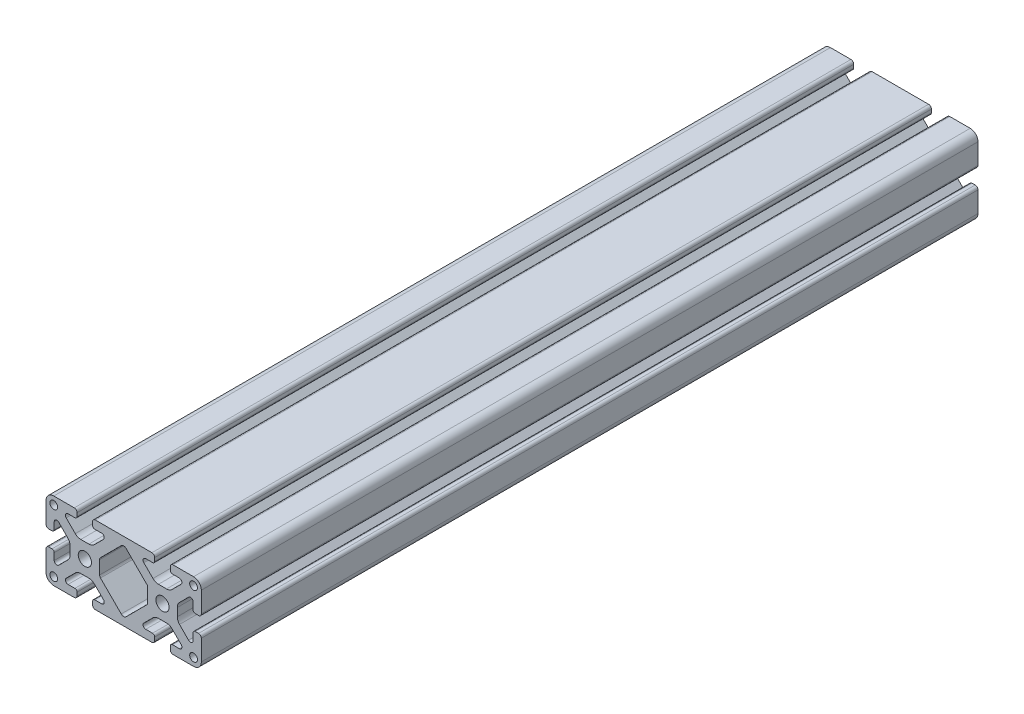
from build123d import *

# Parameters (mm, degrees)
SKETCH4_W              = 100
SKETCH4_H              = 50
BODY_DEPTH             = 500
CUT_PROFILE_DEPTH      = 257.173769149
CUT_PROFILE_DEPTH_BACK = 257.173769149
SKETCH6_OUTSIDE_W      = 204.47
SKETCH6_OUTSIDE_H      = 154.47
SKETCH6_OUTSIDE_R      = 4.25
SKETCH6_OUTSIDE_R_2    = 2.5


with BuildPart() as part:
    # Sketch4 → Body (new body)
    with BuildSketch(Plane.XY.offset(250)):
        Rectangle(SKETCH4_W, SKETCH4_H)
    extrude(amount=-BODY_DEPTH)

    # Sketch6 outside → Cut-Profile (cut, two sides: drawn at the far end of the back side and taken through both)
    # profile 1 of 8: a face of its own
    with BuildSketch(Plane.XY.offset(-CUT_PROFILE_DEPTH_BACK)):
        Rectangle(SKETCH6_OUTSIDE_W, SKETCH6_OUTSIDE_H)
        with BuildLine():
            Line((-31.4, -19.7), (-35.8, -19.7))
            ThreePointArc((-35.8, -19.7), (-37.371513222, -18.648341109), (-36.998678382, -16.794524933))
            Line((-36.998678382, -16.794524933), (-31.125524653, -10.954485098))
            ThreePointArc((-31.125524653, -10.954485098), (-29.506885614, -9.877902288), (-27.6, -9.5))
            Line((-27.6, -9.5), (-22.4, -9.5))
            ThreePointArc((-22.4, -9.5), (-20.493114386, -9.877902288), (-18.874475347, -10.954485098))
            Line((-18.874475347, -10.954485098), (-13.001321618, -16.794524933))
            ThreePointArc((-13.001321618, -16.794524933), (-12.628486778, -18.648341109), (-14.2, -19.7))
            Line((-14.2, -19.7), (-18.6, -19.7))
            ThreePointArc((-18.6, -19.7), (-19.589949494, -20.110050506), (-20, -21.1))
            Line((-20, -21.1), (-20, -23.2))
            ThreePointArc((-20, -23.2), (-19.472792206, -24.472792206), (-18.2, -25))
            Line((-18.2, -25), (18.2, -25))
            ThreePointArc((18.2, -25), (19.472792206, -24.472792206), (20, -23.2))
            Line((20, -23.2), (20, -21.1))
            ThreePointArc((20, -21.1), (19.589949494, -20.110050506), (18.6, -19.7))
            Line((18.6, -19.7), (14.2, -19.7))
            ThreePointArc((14.2, -19.7), (12.628486778, -18.648341109), (13.001321618, -16.794524933))
            Line((13.001321618, -16.794524933), (18.874475347, -10.954485098))
            ThreePointArc((18.874475347, -10.954485098), (20.493114386, -9.877902288), (22.4, -9.5))
            Line((22.4, -9.5), (27.6, -9.5))
            ThreePointArc((27.6, -9.5), (29.506885614, -9.877902288), (31.125524653, -10.954485098))
            Line((31.125524653, -10.954485098), (36.998678382, -16.794524933))
            ThreePointArc((36.998678382, -16.794524933), (37.371513222, -18.648341109), (35.8, -19.7))
            Line((35.8, -19.7), (31.4, -19.7))
            ThreePointArc((31.4, -19.7), (30.410050506, -20.110050506), (30, -21.1))
            Line((30, -21.1), (30, -23.2))
            ThreePointArc((30, -23.2), (30.527207794, -24.472792206), (31.8, -25))
            Line((31.8, -25), (45, -25))
            ThreePointArc((45, -25), (48.535533906, -23.535533906), (50, -20))
            Line((50, -20), (50, -6.8))
            ThreePointArc((50, -6.8), (49.472792206, -5.527207794), (48.2, -5))
            Line((48.2, -5), (46.1, -5))
            ThreePointArc((46.1, -5), (45.110050506, -5.410050506), (44.7, -6.4))
            Line((44.7, -6.4), (44.7, -10.8))
            ThreePointArc((44.7, -10.8), (43.648341109, -12.371513222), (41.794524933, -11.998678382))
            Line((41.794524933, -11.998678382), (35.954485098, -6.125524653))
            ThreePointArc((35.954485098, -6.125524653), (34.877902288, -4.506885614), (34.5, -2.6))
            Line((34.5, -2.6), (34.5, 2.6))
            ThreePointArc((34.5, 2.6), (34.877902288, 4.506885614), (35.954485098, 6.125524653))
            Line((35.954485098, 6.125524653), (41.794524933, 11.998678382))
            ThreePointArc((41.794524933, 11.998678382), (43.648341109, 12.371513222), (44.7, 10.8))
            Line((44.7, 10.8), (44.7, 6.4))
            ThreePointArc((44.7, 6.4), (45.110050506, 5.410050506), (46.1, 5))
            Line((46.1, 5), (48.2, 5))
            ThreePointArc((48.2, 5), (49.472792206, 5.527207794), (50, 6.8))
            Line((50, 6.8), (50, 20))
            ThreePointArc((50, 20), (48.535533906, 23.535533906), (45, 25))
            Line((45, 25), (31.8, 25))
            ThreePointArc((31.8, 25), (30.527207794, 24.472792206), (30, 23.2))
            Line((30, 23.2), (30, 21.1))
            ThreePointArc((30, 21.1), (30.410050506, 20.110050506), (31.4, 19.7))
            Line((31.4, 19.7), (35.8, 19.7))
            ThreePointArc((35.8, 19.7), (37.371513222, 18.648341109), (36.998678382, 16.794524933))
            Line((36.998678382, 16.794524933), (31.125524653, 10.954485098))
            ThreePointArc((31.125524653, 10.954485098), (29.506885614, 9.877902288), (27.6, 9.5))
            Line((27.6, 9.5), (22.4, 9.5))
            ThreePointArc((22.4, 9.5), (20.493114386, 9.877902288), (18.874475347, 10.954485098))
            Line((18.874475347, 10.954485098), (13.001321618, 16.794524933))
            ThreePointArc((13.001321618, 16.794524933), (12.628486778, 18.648341109), (14.2, 19.7))
            Line((14.2, 19.7), (18.6, 19.7))
            ThreePointArc((18.6, 19.7), (19.589949494, 20.110050506), (20, 21.1))
            Line((20, 21.1), (20, 23.2))
            ThreePointArc((20, 23.2), (19.472792206, 24.472792206), (18.2, 25))
            Line((18.2, 25), (-18.2, 25))
            ThreePointArc((-18.2, 25), (-19.472792206, 24.472792206), (-20, 23.2))
            Line((-20, 23.2), (-20, 21.1))
            ThreePointArc((-20, 21.1), (-19.589949494, 20.110050506), (-18.6, 19.7))
            Line((-18.6, 19.7), (-14.2, 19.7))
            ThreePointArc((-14.2, 19.7), (-12.628486778, 18.648341109), (-13.001321618, 16.794524933))
            Line((-13.001321618, 16.794524933), (-18.874475347, 10.954485098))
            ThreePointArc((-18.874475347, 10.954485098), (-20.493114386, 9.877902288), (-22.4, 9.5))
            Line((-22.4, 9.5), (-27.6, 9.5))
            ThreePointArc((-27.6, 9.5), (-29.506885614, 9.877902288), (-31.125524653, 10.954485098))
            Line((-31.125524653, 10.954485098), (-36.998678382, 16.794524933))
            ThreePointArc((-36.998678382, 16.794524933), (-37.371513222, 18.648341109), (-35.8, 19.7))
            Line((-35.8, 19.7), (-31.4, 19.7))
            ThreePointArc((-31.4, 19.7), (-30.410050506, 20.110050506), (-30, 21.1))
            Line((-30, 21.1), (-30, 23.2))
            ThreePointArc((-30, 23.2), (-30.527207794, 24.472792206), (-31.8, 25))
            Line((-31.8, 25), (-45, 25))
            ThreePointArc((-45, 25), (-48.535533906, 23.535533906), (-50, 20))
            Line((-50, 20), (-50, 6.8))
            ThreePointArc((-50, 6.8), (-49.472792206, 5.527207794), (-48.2, 5))
            Line((-48.2, 5), (-46.1, 5))
            ThreePointArc((-46.1, 5), (-45.110050506, 5.410050506), (-44.7, 6.4))
            Line((-44.7, 6.4), (-44.7, 10.8))
            ThreePointArc((-44.7, 10.8), (-43.648341109, 12.371513222), (-41.794524933, 11.998678382))
            Line((-41.794524933, 11.998678382), (-35.954485098, 6.125524653))
            ThreePointArc((-35.954485098, 6.125524653), (-34.877902288, 4.506885614), (-34.5, 2.6))
            Line((-34.5, 2.6), (-34.5, -2.6))
            ThreePointArc((-34.5, -2.6), (-34.877902288, -4.506885614), (-35.954485098, -6.125524653))
            Line((-35.954485098, -6.125524653), (-41.794524933, -11.998678382))
            ThreePointArc((-41.794524933, -11.998678382), (-43.648341109, -12.371513222), (-44.7, -10.8))
            Line((-44.7, -10.8), (-44.7, -6.4))
            ThreePointArc((-44.7, -6.4), (-45.110050506, -5.410050506), (-46.1, -5))
            Line((-46.1, -5), (-48.2, -5))
            ThreePointArc((-48.2, -5), (-49.472792206, -5.527207794), (-50, -6.8))
            Line((-50, -6.8), (-50, -20))
            ThreePointArc((-50, -20), (-48.535533906, -23.535533906), (-45, -25))
            Line((-45, -25), (-31.8, -25))
            ThreePointArc((-31.8, -25), (-30.527207794, -24.472792206), (-30, -23.2))
            Line((-30, -23.2), (-30, -21.1))
            ThreePointArc((-30, -21.1), (-30.410050506, -20.110050506), (-31.4, -19.7))
        make_face(mode=Mode.SUBTRACT)
    # profile 2 of 8: a face of its own
    with BuildSketch(Plane.XY.offset(-CUT_PROFILE_DEPTH_BACK)):
        with Locations((25, 0)):
            Circle(SKETCH6_OUTSIDE_R)
    # profile 3 of 8: a face of its own
    with BuildSketch(Plane.XY.offset(-CUT_PROFILE_DEPTH_BACK)):
        with Locations((45, -20)):
            Circle(SKETCH6_OUTSIDE_R_2)
    # profile 4 of 8: a face of its own
    with BuildSketch(Plane.XY.offset(-CUT_PROFILE_DEPTH_BACK)):
        with Locations((45, 20)):
            Circle(SKETCH6_OUTSIDE_R_2)
    # profile 5 of 8: a face of its own
    with BuildSketch(Plane.XY.offset(-CUT_PROFILE_DEPTH_BACK)):
        with Locations((-45, -20)):
            Circle(SKETCH6_OUTSIDE_R_2)
    # profile 6 of 8: a face of its own
    with BuildSketch(Plane.XY.offset(-CUT_PROFILE_DEPTH_BACK)):
        with Locations((-45, 20)):
            Circle(SKETCH6_OUTSIDE_R_2)
    # profile 7 of 8: a face of its own
    with BuildSketch(Plane.XY.offset(-CUT_PROFILE_DEPTH_BACK)):
        with Locations((-25, 0)):
            Circle(SKETCH6_OUTSIDE_R)
    # profile 8 of 8: a face of its own
    with BuildSketch(Plane.XY.offset(-CUT_PROFILE_DEPTH_BACK)):
        with BuildLine():
            Line((14.914213562, 5.685786438), (1.555634919, 19.044365081))
            ThreePointArc((1.555634919, 19.044365081), (0, 19.688730163), (-1.555634919, 19.044365081))
            Line((-1.555634919, 19.044365081), (-14.914213562, 5.685786438))
            ThreePointArc((-14.914213562, 5.685786438), (-15.347759065, 5.03693974), (-15.5, 4.271572875))
            Line((-15.5, 4.271572875), (-15.5, -4.271572875))
            ThreePointArc((-15.5, -4.271572875), (-15.347759065, -5.03693974), (-14.914213562, -5.685786438))
            Line((-14.914213562, -5.685786438), (-1.555634919, -19.044365081))
            ThreePointArc((-1.555634919, -19.044365081), (0, -19.688730163), (1.555634919, -19.044365081))
            Line((1.555634919, -19.044365081), (14.914213562, -5.685786438))
            ThreePointArc((14.914213562, -5.685786438), (15.347759065, -5.03693974), (15.5, -4.271572875))
            Line((15.5, -4.271572875), (15.5, 4.271572875))
            ThreePointArc((15.5, 4.271572875), (15.347759065, 5.03693974), (14.914213562, 5.685786438))
        make_face()
    extrude(amount=CUT_PROFILE_DEPTH + CUT_PROFILE_DEPTH_BACK, mode=Mode.SUBTRACT)


solid = part.part
